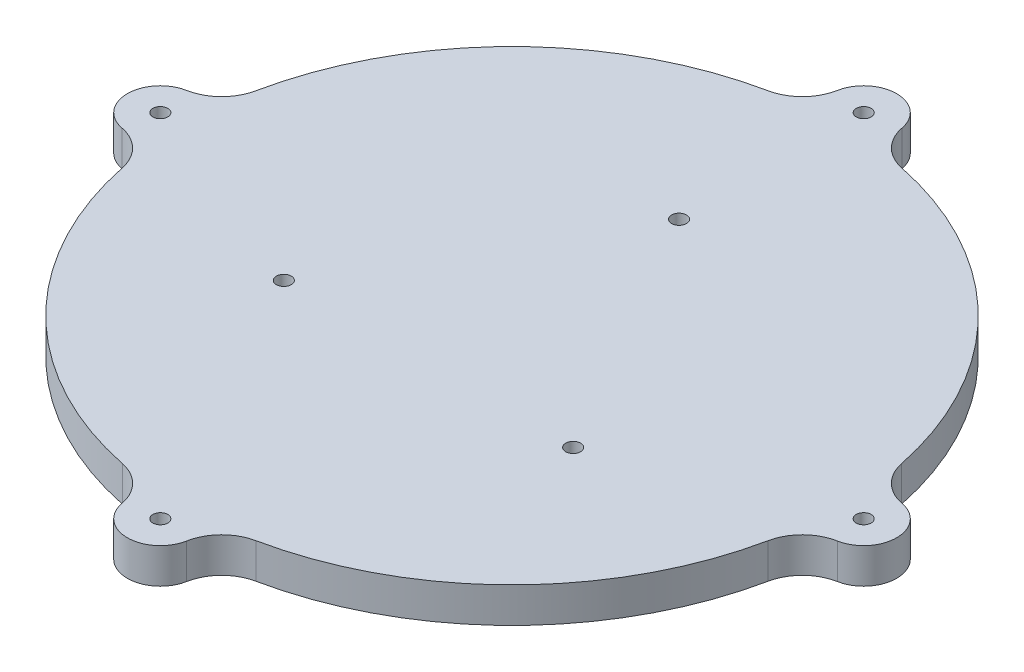
from build123d import *

# Parameters (mm, degrees)
SKETCH1_R           = 1.7
BOSS_EXTRUDE1_DEPTH = 8
FILLET1_R           = 10
SKETCH2_R           = 1.7
CUT_EXTRUDE1_DEPTH  = 39


with BuildPart() as part:
    # Sketch1 → Boss-Extrude1 (new body)
    with BuildSketch(Plane(origin=(0, 0, 0), x_dir=(1, 0, 0), z_dir=(0, 1, 0))):
        with BuildLine():
            ThreePointArc((-5.409133759, 74.8046875), (-53.033008589, 53.033008589), (-74.8046875, 5.409133759))
            ThreePointArc((-74.8046875, 5.409133759), (-87.5, 0), (-74.8046875, -5.409133759))
            ThreePointArc((-74.8046875, -5.409133759), (-53.033008589, -53.033008589), (-5.409133759, -74.8046875))
            ThreePointArc((-5.409133759, -74.8046875), (0, -87.5), (5.409133759, -74.8046875))
            ThreePointArc((5.409133759, -74.8046875), (53.033008589, -53.033008589), (74.8046875, -5.409133759))
            ThreePointArc((74.8046875, -5.409133759), (87.5, 0), (74.8046875, 5.409133759))
            ThreePointArc((74.8046875, 5.409133759), (53.033008589, 53.033008589), (5.409133759, 74.8046875))
            ThreePointArc((5.409133759, 74.8046875), (0, 87.5), (-5.409133759, 74.8046875))
        make_face()
        with Locations(Location((-80, 0, 0), (0, 0, 270))):
            Circle(SKETCH1_R, mode=Mode.SUBTRACT)
        with Locations(Location((80, 0, 0), (0, 0, 270))):
            Circle(SKETCH1_R, mode=Mode.SUBTRACT)
        with Locations(Location((0, 80, 0), (0, 0, 270))):
            Circle(SKETCH1_R, mode=Mode.SUBTRACT)
        with Locations(Location((0, -80, 0), (0, 0, 270))):
            Circle(SKETCH1_R, mode=Mode.SUBTRACT)
    extrude(amount=BOSS_EXTRUDE1_DEPTH)

    # Fillet1
    fillet1_edges = [part.edges().sort_by_distance(p)[0] for p in [
        (74.8046875, 4, -5.409133759),
        (74.8046875, 4, 5.409133759),
        (5.409133759, 4, 74.8046875),
        (-5.409133759, 4, 74.8046875),
        (-74.8046875, 4, 5.409133759),
        (-74.8046875, 4, -5.409133759),
        (-5.409133759, 4, -74.8046875),
        (5.409133759, 4, -74.8046875),
    ]]
    fillet(fillet1_edges, radius=FILLET1_R)

    # Sketch2 → Cut-Extrude1 (cut)
    with BuildSketch(Plane(origin=(0, 8, 0), x_dir=(1, 0, 0), z_dir=(0, 1, 0))):
        with Locations(Location((0, 38, 0), (0, 0, 270))):
            Circle(SKETCH2_R)
        with Locations(Location((32.908965344, -19, 0), (0, 0, 270))):
            Circle(SKETCH2_R)
        with Locations(Location((-32.908965344, -19, 0), (0, 0, 270))):
            Circle(SKETCH2_R)
    extrude(amount=-CUT_EXTRUDE1_DEPTH, mode=Mode.SUBTRACT)


solid = part.part
